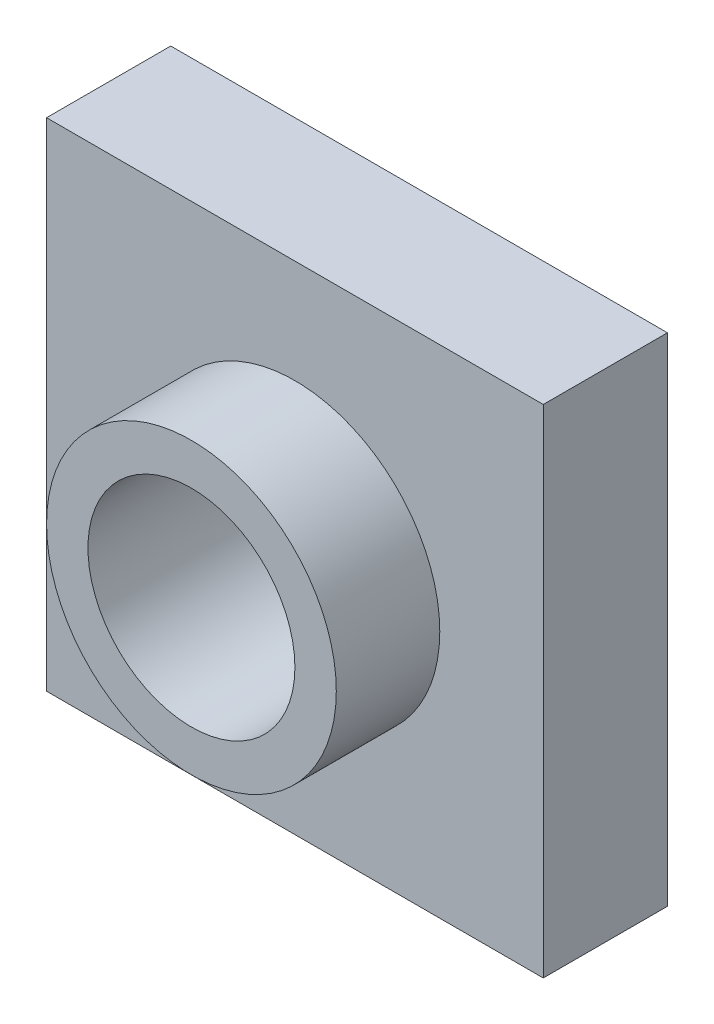
from build123d import *

# Parameters (mm, degrees)
SKETCH2_W           = 120
SKETCH2_H           = 120
BOSS_EXTRUDE1_DEPTH = 30
SKETCH4_R           = 35
BOSS_EXTRUDE2_DEPTH = 25
SKETCH6_R           = 25
CUT_EXTRUDE1_DEPTH  = 179.395627749


with BuildPart() as part:
    # Sketch2 → Boss-Extrude1 (new body)
    with BuildSketch(Plane.XY):
        with Locations((60, 60)):
            Rectangle(SKETCH2_W, SKETCH2_H)
    extrude(amount=BOSS_EXTRUDE1_DEPTH)

    # Sketch4 → Boss-Extrude2 (add)
    with BuildSketch(Plane.XY.offset(30)):
        with Locations(Location((60, 60, 0), (0, 0, 180))):
            Circle(SKETCH4_R)
    extrude(amount=BOSS_EXTRUDE2_DEPTH)

    # Sketch6 → Cut-Extrude1 (cut, through all)
    with BuildSketch(Plane.XY.offset(55)):
        with Locations((60, 60)):
            Circle(SKETCH6_R)
    extrude(amount=-CUT_EXTRUDE1_DEPTH, mode=Mode.SUBTRACT)


solid = part.part
